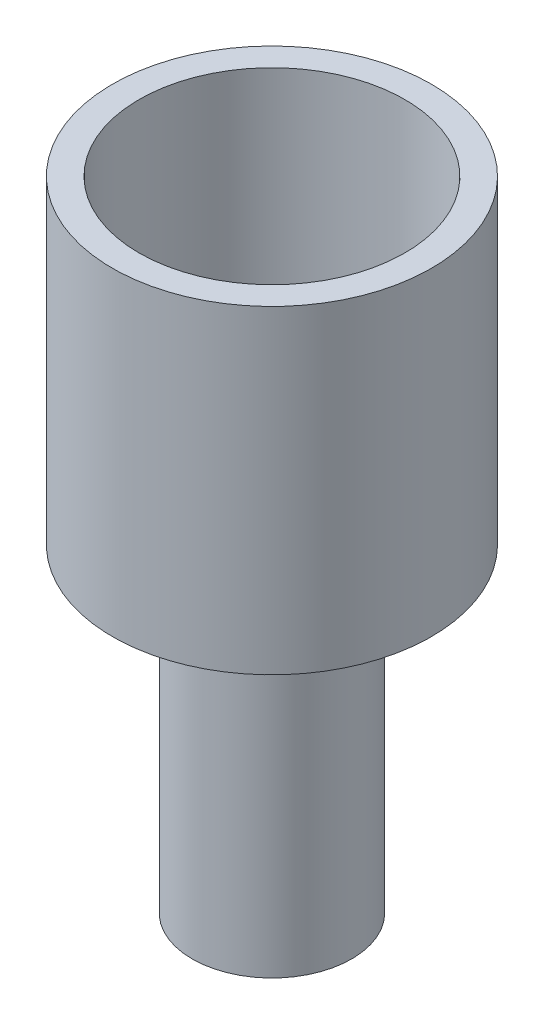
from build123d import *

# Parameters (mm, degrees)
SKETCH2_R                        = 9.525
SKETCH2_R_2                      = 4.7625
BOSS_EXTRUDE1_DEPTH              = 19.05
SKETCH2_3_R                      = 4.7625
BOSS_EXTRUDE2_DEPTH              = 19.05
F_5_8_0_625_DIAMETER_HOLE1_D     = 15.875
F_5_8_0_625_DIAMETER_HOLE1_DEPTH = 14.280668836
F_5_8_0_625_DIAMETER_HOLE1_TIP   = 4.769331164
F_1_4_0_25_DIAMETER_HOLE1_D      = 6.35


with BuildPart() as part:
    # Sketch2 → Boss-Extrude1 (new body)
    # profile 1 of 2: a face of its own
    with BuildSketch(Plane(origin=(0, 0, 0), x_dir=(1, 0, 0), z_dir=(0, 1, 0))):
        with Locations(Location((0, 0, 0), (0, 0, 90))):
            Circle(SKETCH2_R)
        Circle(SKETCH2_R_2, mode=Mode.SUBTRACT)
    # profile 2 of 2: a face of its own
    with BuildSketch(Plane(origin=(0, 0, 0), x_dir=(1, 0, 0), z_dir=(0, 1, 0))):
        Circle(SKETCH2_R_2)
    extrude(amount=BOSS_EXTRUDE1_DEPTH)

    # Sketch2<3> → Boss-Extrude2 (add)
    with BuildSketch(Plane(origin=(0, 0, 0), x_dir=(1, 0, 0), z_dir=(0, 1, 0))):
        with Locations(Location((0, 0, 0), (0, 0, 270))):
            Circle(SKETCH2_3_R)
    extrude(amount=-BOSS_EXTRUDE2_DEPTH)

    # 5/8 (0.625) Diameter Hole1
    with Locations(Plane(origin=(0, 19.05, 0), x_dir=(1, 0, 0), z_dir=(0, 1, 0))):
        with Locations((0, 0)):
            Hole(F_5_8_0_625_DIAMETER_HOLE1_D / 2, depth=F_5_8_0_625_DIAMETER_HOLE1_DEPTH)
            with Locations((0, 0, -(F_5_8_0_625_DIAMETER_HOLE1_DEPTH + F_5_8_0_625_DIAMETER_HOLE1_TIP / 2))):  # 118° drill point
                Cone(0, F_5_8_0_625_DIAMETER_HOLE1_D / 2, F_5_8_0_625_DIAMETER_HOLE1_TIP, mode=Mode.SUBTRACT)

    # 1/4 (0.25) Diameter Hole1 (through all)
    with Locations(Plane(origin=(0, -19.05, 0), x_dir=(-1, 0, 0), z_dir=(0, -1, 0))):
        with Locations((0, 0)):
            Hole(F_1_4_0_25_DIAMETER_HOLE1_D / 2)


solid = part.part
